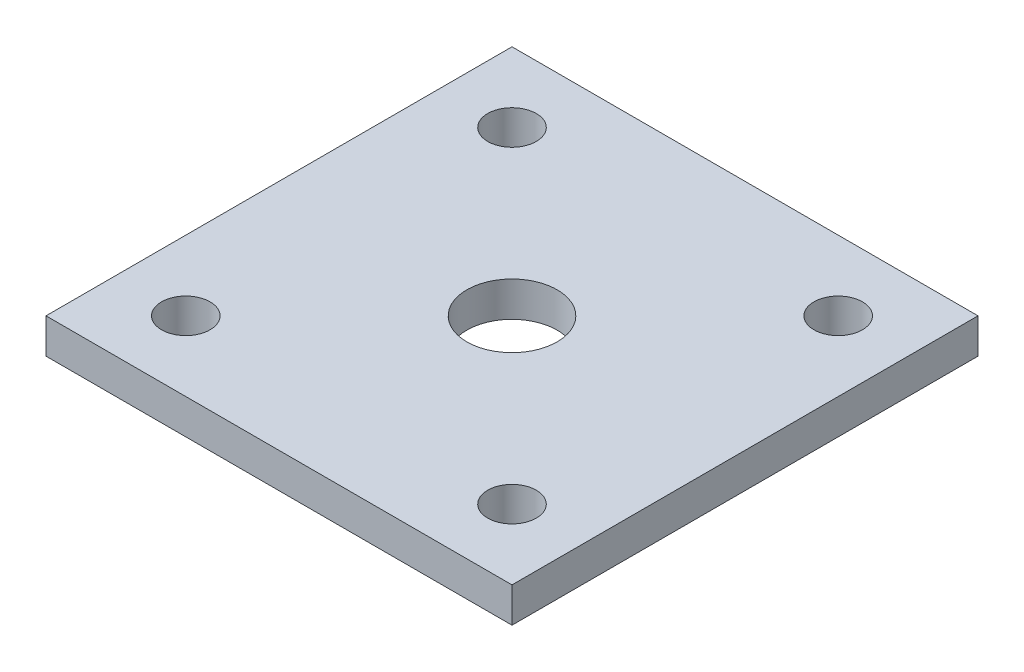
from build123d import *

# Parameters (mm, degrees)
SKETCH1_W           = 40
SKETCH1_H           = 40
SKETCH1_R           = 3.875
SKETCH1_R_2         = 2.0828
BOSS_EXTRUDE1_DEPTH = 3


with BuildPart() as part:
    # Sketch1 → Boss-Extrude1 (new body)
    with BuildSketch(Plane(origin=(0, 0, 0), x_dir=(1, 0, 0), z_dir=(0, 1, 0))):
        with Locations((20, 20)):
            Rectangle(SKETCH1_W, SKETCH1_H)
        with Locations(Location((20, 20, 0), (0, 0, 270))):
            Circle(SKETCH1_R, mode=Mode.SUBTRACT)
        with Locations(Location((6, 34, 0), (0, 0, 270))):
            Circle(SKETCH1_R_2, mode=Mode.SUBTRACT)
        with Locations(Location((6, 6, 0), (0, 0, 270))):
            Circle(SKETCH1_R_2, mode=Mode.SUBTRACT)
        with Locations(Location((34, 6, 0), (0, 0, 270))):
            Circle(SKETCH1_R_2, mode=Mode.SUBTRACT)
        with Locations(Location((34, 34, 0), (0, 0, 270))):
            Circle(SKETCH1_R_2, mode=Mode.SUBTRACT)
    extrude(amount=BOSS_EXTRUDE1_DEPTH)


solid = part.part
